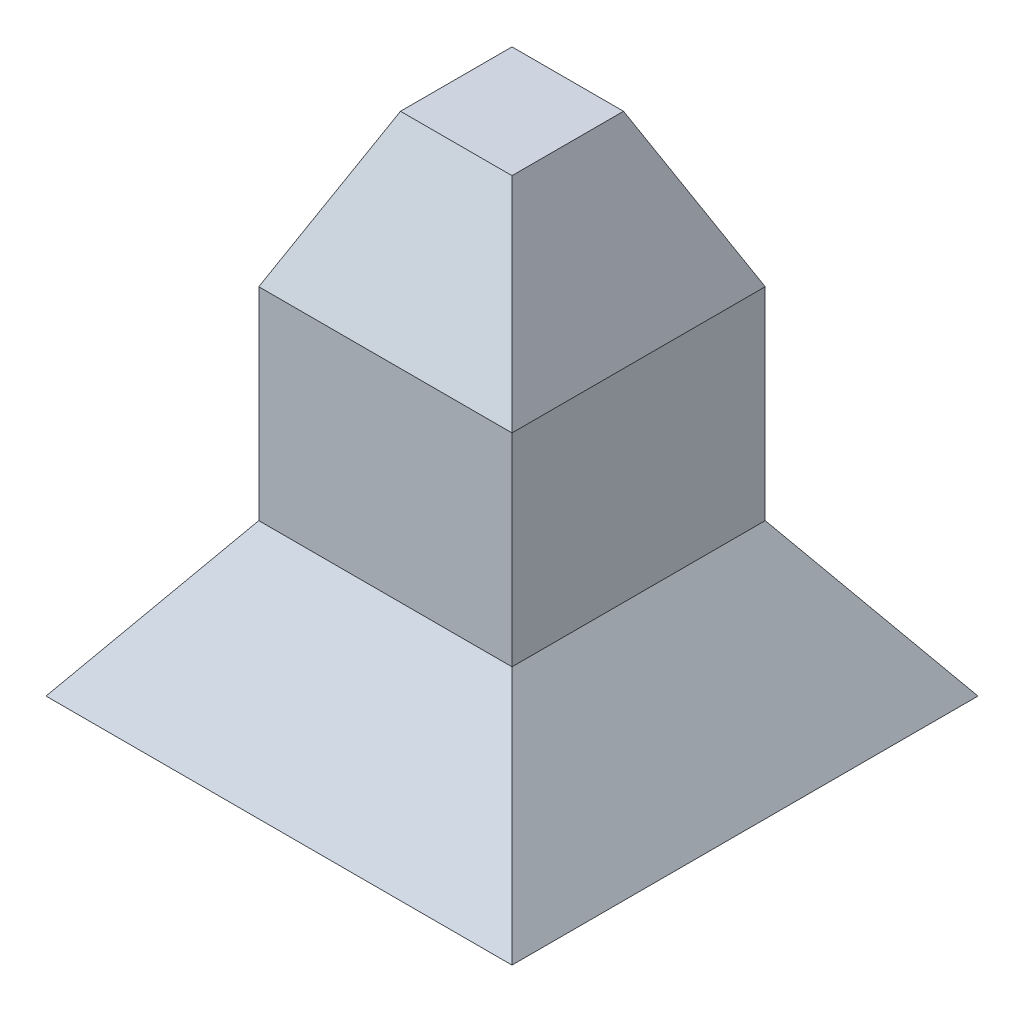
from build123d import *

# Parameters (mm, degrees)
SKETCH1_W           = 100
SKETCH1_H           = 100
BOSS_EXTRUDE1_DEPTH = 80
SKETCH2_W           = 100
SKETCH2_H           = 100
BOSS_EXTRUDE2_DEPTH = 60
BOSS_EXTRUDE2_TAPER = 25
SKETCH3_W           = 100
SKETCH3_H           = 100
BOSS_EXTRUDE3_DEPTH = 60
BOSS_EXTRUDE3_DRAFT = -35
SKETCH4_W           = 144.024904586
SKETCH4_H           = 144.024904586
CUT_EXTRUDE4_DEPTH  = 20
DRAFT1_ANGLE        = 35
SKETCH5_W           = 30
SKETCH5_H           = 30
BOSS_EXTRUDE4_DEPTH = 20
DRAFT2_ANGLE        = 20


with BuildPart() as part:
    # Sketch1 → Boss-Extrude1 (new body)
    with BuildSketch(Plane(origin=(0, 0, 0), x_dir=(1, 0, 0), z_dir=(0, 1, 0))):
        Rectangle(SKETCH1_W, SKETCH1_H)
    extrude(amount=BOSS_EXTRUDE1_DEPTH)

    # Sketch2 → Boss-Extrude2 (add)
    with BuildSketch(Plane(origin=(0, 80, 0), x_dir=(1, 0, 0), z_dir=(0, 1, 0))):
        Rectangle(SKETCH2_W, SKETCH2_H)
    extrude(amount=BOSS_EXTRUDE2_DEPTH, taper=BOSS_EXTRUDE2_TAPER)


with BuildPart() as boss_extrude3_tool:
    # Sketch3 → Boss-Extrude3 (with draft: the straight prism first)
    with BuildSketch(Plane.XZ):
        Rectangle(SKETCH3_W, SKETCH3_H)
    extrude(amount=BOSS_EXTRUDE3_DEPTH)
    # Boss-Extrude3: the draft: its side faces are tilted about the plane it starts from
    boss_extrude3_sides = [boss_extrude3_tool.faces().sort_by_distance(p)[0] for p in [
        (50, -30, 0),
        (0, -30, 50),
        (-50, -30, 0),
        (0, -30, -50),
    ]]
    draft(boss_extrude3_sides, Plane.XZ, BOSS_EXTRUDE3_DRAFT)


with BuildPart() as part_1:
    add(part.part)

    # Boss-Extrude3: add boss_extrude3_tool
    add(boss_extrude3_tool.part)

    # Sketch4 → Cut-Extrude4 (cut)
    with BuildSketch(Plane.XZ.offset(60)):
        Rectangle(SKETCH4_W, SKETCH4_H)
    extrude(amount=-CUT_EXTRUDE4_DEPTH, mode=Mode.SUBTRACT)

    # Draft1
    draft1_faces = [part_1.faces().sort_by_distance(p)[0] for p in [
        (0, -50, -72.012452293),
        (72.012452293, -50, 0),
        (0, -50, 72.012452293),
        (-72.012452293, -50, 0),
    ]]
    draft(draft1_faces, Plane(origin=(0, -40, 0), x_dir=(0, 0, -1), z_dir=(0, -1, 0)), DRAFT1_ANGLE)

    # Sketch5 → Boss-Extrude4 (add)
    with BuildSketch(Plane(origin=(0, 0, -50), x_dir=(-1, 0, 0), z_dir=(0, 0, -1))):
        with Locations((0, 40)):
            Rectangle(SKETCH5_W, SKETCH5_H)
    extrude(amount=BOSS_EXTRUDE4_DEPTH)

    # Draft2
    draft2_faces = [part_1.faces().sort_by_distance(p)[0] for p in [
        (0, 55, -60),
    ]]
    draft(draft2_faces, Plane(origin=(-50, 80, -50), x_dir=(-1, 0, 0), z_dir=(0, 0, -1)), DRAFT2_ANGLE)


solid = part_1.part
